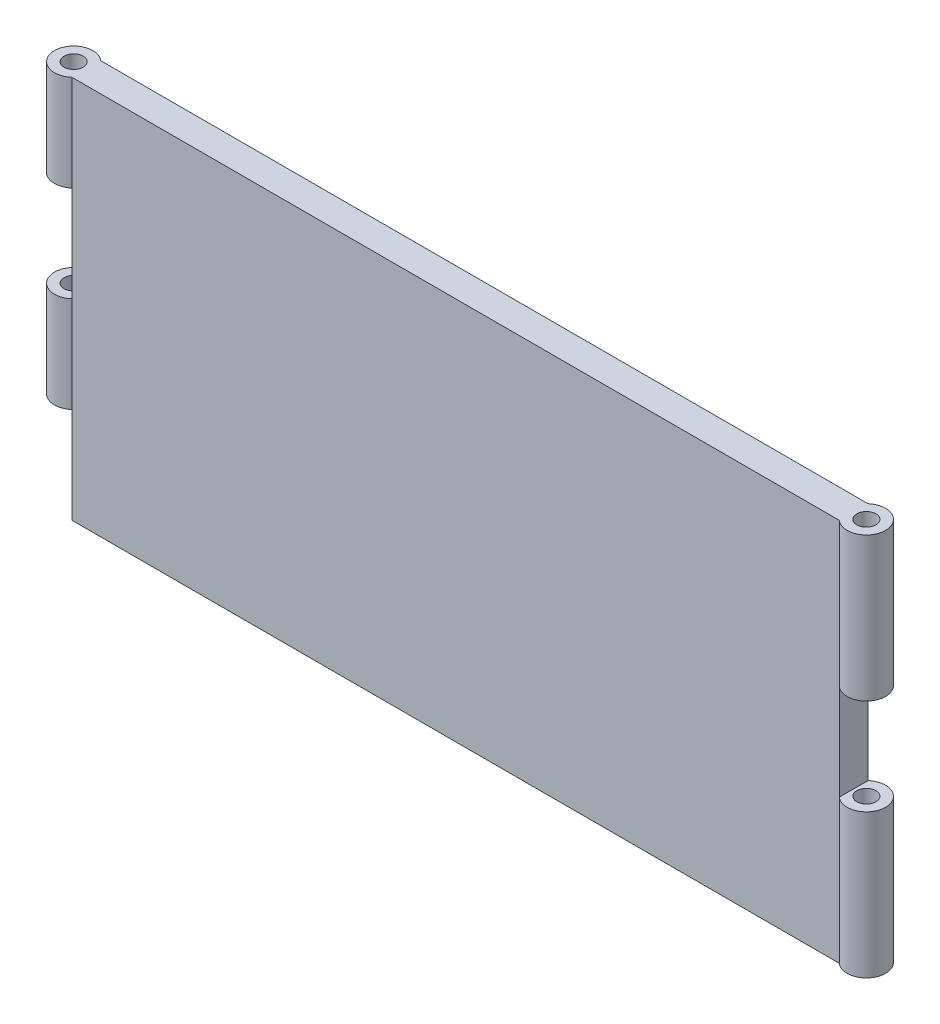
from build123d import *

# Parameters (mm, degrees)
SKETCH1_W           = 80
SKETCH1_H           = 40
BOSS_EXTRUDE1_DEPTH = 3
SKETCH2_R           = 2
SKETCH2_R_2         = 1
BOSS_EXTRUDE3_DEPTH = 10
LPATTERN1_COUNT     = 2
LPATTERN1_PITCH     = 20
SKETCH3_R           = 2
SKETCH3_R_2         = 1
BOSS_EXTRUDE4_DEPTH = 15
LPATTERN2_COUNT     = 2
LPATTERN2_PITCH     = 25


with BuildPart() as part:
    # Sketch1 → Boss-Extrude1 (new body)
    with BuildSketch(Plane.XY):
        Rectangle(SKETCH1_W, SKETCH1_H)
    extrude(amount=BOSS_EXTRUDE1_DEPTH)

    # Sketch2 → Boss-Extrude3 (add)
    with BuildSketch(Plane(origin=(0, 20, 0), x_dir=(1, 0, 0), z_dir=(0, 1, 0))):
        with Locations((-41.322875656, -1.5)):
            Circle(SKETCH2_R)
        with Locations(Location((-41.322875656, -1.5, 0), (0, 0, 270))):
            Circle(SKETCH2_R_2, mode=Mode.SUBTRACT)
    boss_extrude3 = extrude(amount=-BOSS_EXTRUDE3_DEPTH)

    # LPattern1: Boss-Extrude3 ×2
    with Locations(*[(0, -i * LPATTERN1_PITCH, 0) for i in range(1, LPATTERN1_COUNT)]):
        add(boss_extrude3)

    # Sketch3 → Boss-Extrude4 (add)
    with BuildSketch(Plane(origin=(0, 20, 0), x_dir=(1, 0, 0), z_dir=(0, 1, 0))):
        with Locations((41.322875656, -1.5)):
            Circle(SKETCH3_R)
        with Locations(Location((41.322875656, -1.5, 0), (0, 0, 270))):
            Circle(SKETCH3_R_2, mode=Mode.SUBTRACT)
    boss_extrude4 = extrude(amount=-BOSS_EXTRUDE4_DEPTH)

    # LPattern2: Boss-Extrude4 ×2
    with Locations(*[(0, -i * LPATTERN2_PITCH, 0) for i in range(1, LPATTERN2_COUNT)]):
        add(boss_extrude4)


solid = part.part
